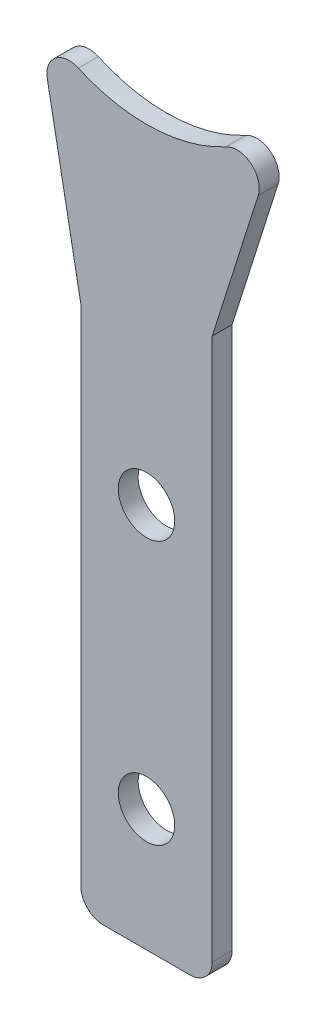
from build123d import *

# Parameters (mm, degrees)
BOSS_EXTRUDE1_DEPTH  = 1.5875
FILLET2_R            = 1.778
M4_CLEARANCE_HOLE2_D = 4.5


with BuildPart() as part:
    # Sketch1 → Boss-Extrude1 (new body)
    with BuildSketch(Plane.XY):
        with BuildLine():
            Line((-3.078924099, 16.382133449), (-3.078924099, -25.617866551))
            Line((-3.078924099, -25.617866551), (2.159951047, -25.617866551))
            Line((2.159951047, -25.617866551), (7.399260817, -25.617866551))
            Line((7.399260817, -25.617866551), (7.399260817, 4.381445812))
            Line((7.399260817, 4.381445812), (7.399260817, 19.381445781))
            Line((7.399260817, 19.381445781), (13.018541309, 37.070554481))
            ThreePointArc((13.018541309, 37.070554481), (3.802061978, 31.484715671), (-6.508003397, 34.622810382))
            Line((-6.508003397, 34.622810382), (-3.078924099, 16.382133449))
        make_face()
    extrude(amount=BOSS_EXTRUDE1_DEPTH)

    # Fillet2
    fillet2_edges = [part.edges().sort_by_distance(p)[0] for p in [
        (-3.078924099, -25.617866551, 0.79375),
        (-6.508003397, 34.622810382, 0.79375),
        (13.018541309, 37.070554481, 0.79375),
        (7.399260817, -25.617866551, 0.79375),
    ]]
    fillet(fillet2_edges, radius=FILLET2_R)

    # M4 Clearance Hole2 (through all)
    with Locations(Plane.XY.offset(1.5875)):
        with Locations((2.160168359, 5.103784263), (2.160168359, -15.895866551)):
            Hole(M4_CLEARANCE_HOLE2_D / 2)


solid = part.part
